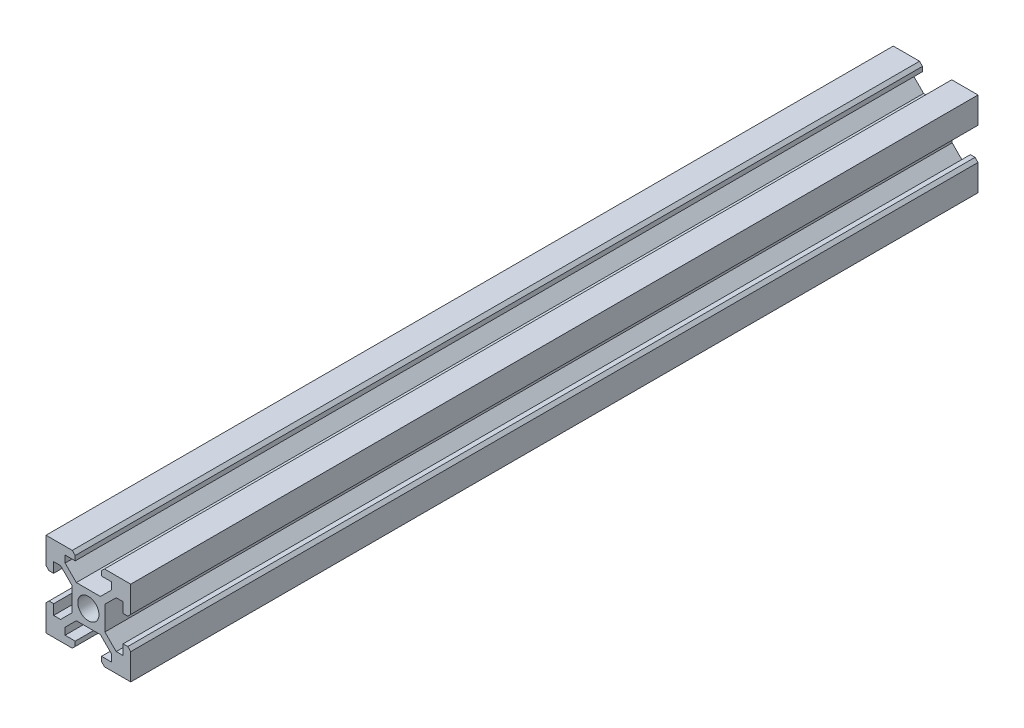
from build123d import *

# Parameters (mm, degrees)
SKETCH1_R           = 2.5
BOSS_EXTRUDE1_DEPTH = 100


with BuildPart() as part:
    # Sketch1 → Boss-Extrude1 (new, symmetric)
    with BuildSketch(Plane.XY):
        Polygon((3.9, -2.839339828), (6.560660172, -5.5), (8.200660172, -5.5), (8.200660172, -3.1), (9.3, -3.1), (10, -3.8), (10, -10), (3.8, -10), (3.1, -9.3), (3.1, -8.200660172), (5.5, -8.200660172), (5.5, -6.560660172), (2.839339828, -3.9), (-2.839339828, -3.9), (-5.5, -6.560660172), (-5.5, -8.200660172), (-3.1, -8.200660172), (-3.1, -9.3), (-3.8, -10), (-10, -10), (-10, -3.8), (-9.3, -3.1), (-8.200660172, -3.1), (-8.200660172, -5.5), (-6.560660172, -5.5), (-3.9, -2.839339828), (-3.9, 2.839339828), (-6.560660172, 5.5), (-8.200660172, 5.5), (-8.200660172, 3.1), (-9.3, 3.1), (-10, 3.8), (-10, 10), (-3.8, 10), (-3.1, 9.3), (-3.1, 8.200660172), (-5.5, 8.200660172), (-5.5, 6.560660172), (-2.839339828, 3.9), (2.839339828, 3.9), (5.5, 6.560660172), (5.5, 8.200660172), (3.1, 8.200660172), (3.1, 9.3), (3.8, 10), (10, 10), (10, 3.8), (9.3, 3.1), (8.200660172, 3.1), (8.200660172, 5.5), (6.560660172, 5.5), (3.9, 2.839339828), align=None)
        Circle(SKETCH1_R, mode=Mode.SUBTRACT)
    extrude(amount=BOSS_EXTRUDE1_DEPTH, both=True)


solid = part.part
